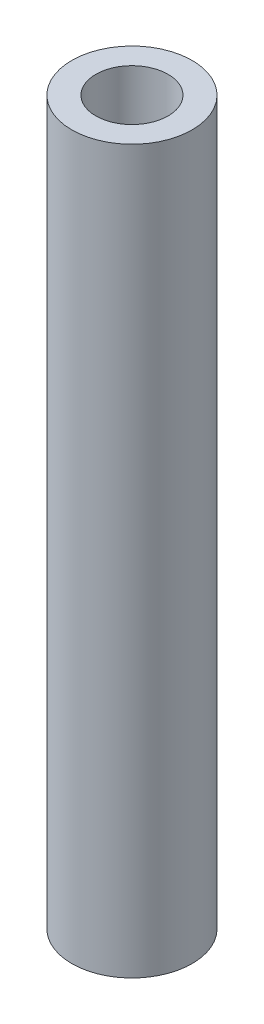
from build123d import *

# Parameters (mm, degrees)
SKETCH1_R           = 2.5
SKETCH1_R_2         = 1.5
BOSS_EXTRUDE1_DEPTH = 30


with BuildPart() as part:
    # Sketch1 → Boss-Extrude1 (new body)
    with BuildSketch(Plane(origin=(0, 0, 0), x_dir=(1, 0, 0), z_dir=(0, 1, 0))):
        with Locations(Location((0, 0, 0), (0, 0, 270))):
            Circle(SKETCH1_R)
        with Locations(Location((0, 0, 0), (0, 0, 270))):
            Circle(SKETCH1_R_2, mode=Mode.SUBTRACT)
    extrude(amount=BOSS_EXTRUDE1_DEPTH)


solid = part.part
